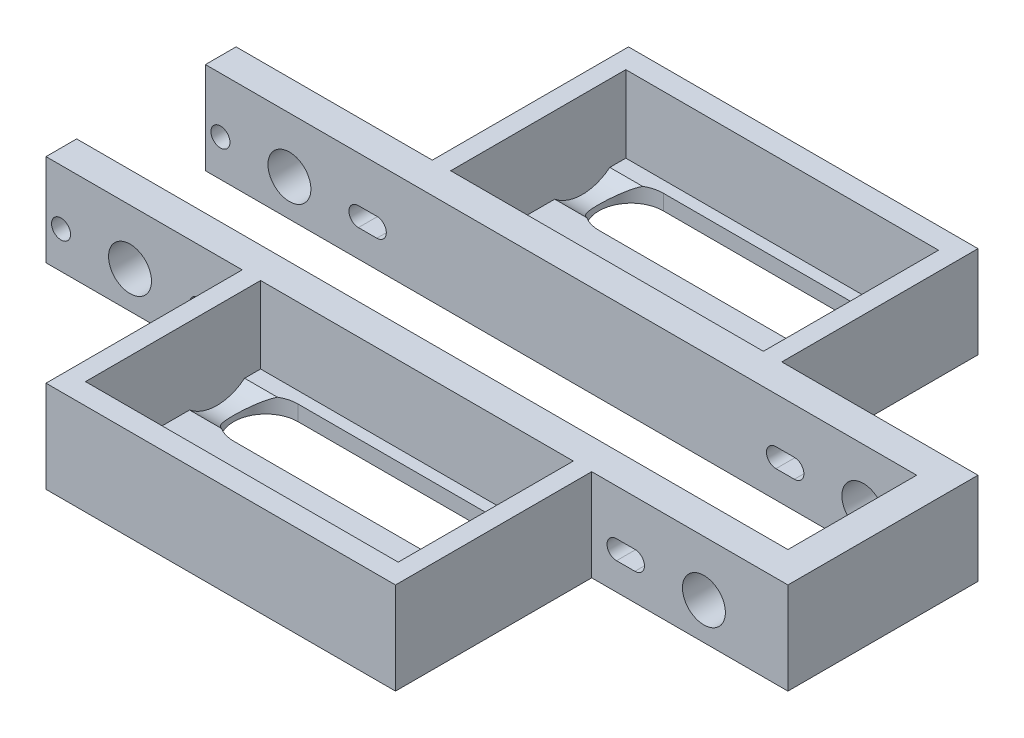
from build123d import *

# Parameters (mm, degrees)
SKETCH1_W                  = 51
SKETCH1_H                  = 28.56
TOTALHEIGHT_DEPTH          = 15
SKETCH1_3_W                = 51
SKETCH1_3_H                = 28.56
FLOORHEIGHT_DEPTH          = 2.5
HOLESFORBEARINGMOUNT_REACH = 139.241
SKETCH2_R                  = 1.55
SKETCH2_R_2                = 3.5
CUT_EXTRUDE2_REACH         = 131.019


with BuildPart() as part:
    # Sketch1 → TotalHeight (new body)
    with BuildSketch(Plane(origin=(0, 0, 0), x_dir=(1, 0, 0), z_dir=(0, 1, 0))):
        Polygon((32, 32), (32, 0), (89, 0), (89, 32), (121, 32), (121, 47.5), (121, 63), (89, 63), (89, 95), (32, 95), (32, 63), (0, 63), (0, 58), (5, 58), (116, 58), (116, 37), (5, 37), (0, 37), (0, 32), align=None)
        with Locations((60.5, 17.72)):
            Rectangle(SKETCH1_W, SKETCH1_H, mode=Mode.SUBTRACT)
        with Locations((60.5, 77.28)):
            Rectangle(SKETCH1_W, SKETCH1_H, mode=Mode.SUBTRACT)
    extrude(amount=TOTALHEIGHT_DEPTH)

    # Sketch1<3> → FloorHeight (add)
    # profile 1 of 2: a face of its own
    with BuildSketch(Plane(origin=(0, 0, 0), x_dir=(1, 0, 0), z_dir=(0, 1, 0))):
        with Locations((60.5, 77.28)):
            Rectangle(SKETCH1_3_W, SKETCH1_3_H)
        with BuildLine():
            ThreePointArc((78, 79.17), (83.25, 84.42), (78, 89.67))
            Line((78, 89.67), (43, 89.67))
            ThreePointArc((43, 89.67), (37.75, 84.42), (43, 79.17))
            Line((43, 79.17), (78, 79.17))
        make_face(mode=Mode.SUBTRACT)
        with BuildLine():
            Line((43, 75.39), (78, 75.39))
            ThreePointArc((78, 75.39), (83.25, 70.14), (78, 64.89))
            Line((78, 64.89), (43, 64.89))
            ThreePointArc((43, 64.89), (37.75, 70.14), (43, 75.39))
        make_face(mode=Mode.SUBTRACT)
    # profile 2 of 2: a face of its own
    with BuildSketch(Plane(origin=(0, 0, 0), x_dir=(1, 0, 0), z_dir=(0, 1, 0))):
        with Locations((60.5, 17.72)):
            Rectangle(SKETCH1_3_W, SKETCH1_3_H)
        with BuildLine():
            ThreePointArc((78, 19.61), (83.25, 24.86), (78, 30.11))
            Line((78, 30.11), (43, 30.11))
            ThreePointArc((43, 30.11), (37.75, 24.86), (43, 19.61))
            Line((43, 19.61), (78, 19.61))
        make_face(mode=Mode.SUBTRACT)
        with BuildLine():
            Line((43, 15.83), (78, 15.83))
            ThreePointArc((78, 15.83), (83.25, 10.58), (78, 5.33))
            Line((78, 5.33), (43, 5.33))
            ThreePointArc((43, 5.33), (37.75, 10.58), (43, 15.83))
        make_face(mode=Mode.SUBTRACT)
    extrude(amount=FLOORHEIGHT_DEPTH)

    # HolesForBearingMount: up to this face of the body (flat: up to its plane)
    holesforbearingmount_end = Plane(part.part.faces().sort_by_distance((16, 7.5, -63))[0])
    # Sketch2 → HolesForBearingMount (cut, up to the picked face)
    with BuildSketch(Plane.XY.offset(-32), mode=Mode.PRIVATE) as holesforbearingmount_sk1:
        with Locations((2.45, 6)):
            Circle(SKETCH2_R)
    holesforbearingmount_tool1 = split(extrude(holesforbearingmount_sk1.sketch, amount=-HOLESFORBEARINGMOUNT_REACH, mode=Mode.PRIVATE), bisect_by=holesforbearingmount_end, keep=Keep.BOTH, mode=Mode.PRIVATE)
    # Sketch2 → HolesForBearingMount (cut, up to the picked face)
    with BuildSketch(Plane.XY.offset(-32), mode=Mode.PRIVATE) as holesforbearingmount_sk2:
        with Locations((13.7, 6)):
            Circle(SKETCH2_R_2)
    holesforbearingmount_tool2 = split(extrude(holesforbearingmount_sk2.sketch, amount=-HOLESFORBEARINGMOUNT_REACH, mode=Mode.PRIVATE), bisect_by=holesforbearingmount_end, keep=Keep.BOTH, mode=Mode.PRIVATE)
    # Sketch2 → HolesForBearingMount (cut, up to the picked face)
    with BuildSketch(Plane.XY.offset(-32), mode=Mode.PRIVATE) as holesforbearingmount_sk3:
        with BuildLine():
            Line((24.95, 4.45), (27.95, 4.45))
            ThreePointArc((27.95, 4.45), (29.5, 6), (27.95, 7.55))
            Line((27.95, 7.55), (24.95, 7.55))
            ThreePointArc((24.95, 7.55), (23.4, 6), (24.95, 4.45))
        make_face()
    holesforbearingmount_tool3 = split(extrude(holesforbearingmount_sk3.sketch, amount=-HOLESFORBEARINGMOUNT_REACH, mode=Mode.PRIVATE), bisect_by=holesforbearingmount_end, keep=Keep.BOTH, mode=Mode.PRIVATE)
    # Sketch2 → HolesForBearingMount (cut, up to the picked face)
    with BuildSketch(Plane.XY.offset(-32), mode=Mode.PRIVATE) as holesforbearingmount_sk4:
        with BuildLine():
            ThreePointArc((93.05, 4.45), (91.5, 6), (93.05, 7.55))
            Line((93.05, 7.55), (96.05, 7.55))
            ThreePointArc((96.05, 7.55), (97.6, 6), (96.05, 4.45))
            Line((96.05, 4.45), (93.05, 4.45))
        make_face()
    holesforbearingmount_tool4 = split(extrude(holesforbearingmount_sk4.sketch, amount=-HOLESFORBEARINGMOUNT_REACH, mode=Mode.PRIVATE), bisect_by=holesforbearingmount_end, keep=Keep.BOTH, mode=Mode.PRIVATE)
    # Sketch2 → HolesForBearingMount (cut, up to the picked face)
    with BuildSketch(Plane.XY.offset(-32), mode=Mode.PRIVATE) as holesforbearingmount_sk5:
        with Locations((107.3, 6)):
            Circle(SKETCH2_R_2)
    holesforbearingmount_tool5 = split(extrude(holesforbearingmount_sk5.sketch, amount=-HOLESFORBEARINGMOUNT_REACH, mode=Mode.PRIVATE), bisect_by=holesforbearingmount_end, keep=Keep.BOTH, mode=Mode.PRIVATE)
    add(holesforbearingmount_tool1.solids().sort_by(Axis((2.45, 6, -32), (0, 0, -1)))[0], mode=Mode.SUBTRACT)
    add(holesforbearingmount_tool2.solids().sort_by(Axis((13.7, 6, -32), (0, 0, -1)))[0], mode=Mode.SUBTRACT)
    add(holesforbearingmount_tool3.solids().sort_by(Axis((26.45, 6, -32), (0, 0, -1)))[0], mode=Mode.SUBTRACT)
    add(holesforbearingmount_tool4.solids().sort_by(Axis((94.55, 6, -32), (0, 0, -1)))[0], mode=Mode.SUBTRACT)
    add(holesforbearingmount_tool5.solids().sort_by(Axis((107.3, 6, -32), (0, 0, -1)))[0], mode=Mode.SUBTRACT)

    # Cut-Extrude2: up to this face of the body (flat: up to its plane)
    cut_extrude2_end = Plane(part.part.faces().sort_by_distance((35, 8.75, -17.72))[0])
    # Sketch3 → Cut-Extrude2 (cut, up to the picked face)
    with BuildSketch(Plane.ZY.offset(-86), mode=Mode.PRIVATE) as cut_extrude2_sk1:
        with BuildLine():
            ThreePointArc((-77.36, 8), (-87.503934876, 14.414394786), (-88.949988864, 2.5))
            Line((-88.949988864, 2.5), (-79.970011136, 2.5))
            ThreePointArc((-79.970011136, 2.5), (-78.045605214, 4.956065124), (-77.36, 8))
        make_face()
    cut_extrude2_tool1 = split(extrude(cut_extrude2_sk1.sketch, amount=CUT_EXTRUDE2_REACH, mode=Mode.PRIVATE), bisect_by=cut_extrude2_end, keep=Keep.BOTH, mode=Mode.PRIVATE)
    # Sketch3 → Cut-Extrude2 (cut, up to the picked face)
    with BuildSketch(Plane.ZY.offset(-86), mode=Mode.PRIVATE) as cut_extrude2_sk2:
        with BuildLine():
            Line((-79.970011136, 2.5), (-88.949988864, 2.5))
            ThreePointArc((-88.949988864, 2.5), (-84.46, 0.9), (-79.970011136, 2.5))
        make_face()
    cut_extrude2_tool2 = split(extrude(cut_extrude2_sk2.sketch, amount=CUT_EXTRUDE2_REACH, mode=Mode.PRIVATE), bisect_by=cut_extrude2_end, keep=Keep.BOTH, mode=Mode.PRIVATE)
    # Sketch3 → Cut-Extrude2 (cut, up to the picked face)
    with BuildSketch(Plane.ZY.offset(-86), mode=Mode.PRIVATE) as cut_extrude2_sk3:
        with BuildLine():
            ThreePointArc((-63, 8), (-73.143934876, 14.414394786), (-74.589988864, 2.5))
            Line((-74.589988864, 2.5), (-65.610011136, 2.5))
            ThreePointArc((-65.610011136, 2.5), (-63.685605214, 4.956065124), (-63, 8))
        make_face()
    cut_extrude2_tool3 = split(extrude(cut_extrude2_sk3.sketch, amount=CUT_EXTRUDE2_REACH, mode=Mode.PRIVATE), bisect_by=cut_extrude2_end, keep=Keep.BOTH, mode=Mode.PRIVATE)
    # Sketch3 → Cut-Extrude2 (cut, up to the picked face)
    with BuildSketch(Plane.ZY.offset(-86), mode=Mode.PRIVATE) as cut_extrude2_sk4:
        with BuildLine():
            Line((-65.610011136, 2.5), (-74.589988864, 2.5))
            ThreePointArc((-74.589988864, 2.5), (-70.1, 0.9), (-65.610011136, 2.5))
        make_face()
    cut_extrude2_tool4 = split(extrude(cut_extrude2_sk4.sketch, amount=CUT_EXTRUDE2_REACH, mode=Mode.PRIVATE), bisect_by=cut_extrude2_end, keep=Keep.BOTH, mode=Mode.PRIVATE)
    # Sketch3 → Cut-Extrude2 (cut, up to the picked face)
    with BuildSketch(Plane.ZY.offset(-86), mode=Mode.PRIVATE) as cut_extrude2_sk5:
        with BuildLine():
            ThreePointArc((-17.8, 8), (-27.943934876, 14.414394786), (-29.389988864, 2.5))
            Line((-29.389988864, 2.5), (-20.410011136, 2.5))
            ThreePointArc((-20.410011136, 2.5), (-18.485605214, 4.956065124), (-17.8, 8))
        make_face()
    cut_extrude2_tool5 = split(extrude(cut_extrude2_sk5.sketch, amount=CUT_EXTRUDE2_REACH, mode=Mode.PRIVATE), bisect_by=cut_extrude2_end, keep=Keep.BOTH, mode=Mode.PRIVATE)
    # Sketch3 → Cut-Extrude2 (cut, up to the picked face)
    with BuildSketch(Plane.ZY.offset(-86), mode=Mode.PRIVATE) as cut_extrude2_sk6:
        with BuildLine():
            Line((-20.410011136, 2.5), (-29.389988864, 2.5))
            ThreePointArc((-29.389988864, 2.5), (-24.9, 0.9), (-20.410011136, 2.5))
        make_face()
    cut_extrude2_tool6 = split(extrude(cut_extrude2_sk6.sketch, amount=CUT_EXTRUDE2_REACH, mode=Mode.PRIVATE), bisect_by=cut_extrude2_end, keep=Keep.BOTH, mode=Mode.PRIVATE)
    # Sketch3 → Cut-Extrude2 (cut, up to the picked face)
    with BuildSketch(Plane.ZY.offset(-86), mode=Mode.PRIVATE) as cut_extrude2_sk7:
        with BuildLine():
            ThreePointArc((-3.44, 8), (-13.583934876, 14.414394786), (-15.029988864, 2.5))
            Line((-15.029988864, 2.5), (-6.050011136, 2.5))
            ThreePointArc((-6.050011136, 2.5), (-4.125605214, 4.956065124), (-3.44, 8))
        make_face()
    cut_extrude2_tool7 = split(extrude(cut_extrude2_sk7.sketch, amount=CUT_EXTRUDE2_REACH, mode=Mode.PRIVATE), bisect_by=cut_extrude2_end, keep=Keep.BOTH, mode=Mode.PRIVATE)
    # Sketch3 → Cut-Extrude2 (cut, up to the picked face)
    with BuildSketch(Plane.ZY.offset(-86), mode=Mode.PRIVATE) as cut_extrude2_sk8:
        with BuildLine():
            Line((-6.050011136, 2.5), (-15.029988864, 2.5))
            ThreePointArc((-15.029988864, 2.5), (-10.54, 0.9), (-6.050011136, 2.5))
        make_face()
    cut_extrude2_tool8 = split(extrude(cut_extrude2_sk8.sketch, amount=CUT_EXTRUDE2_REACH, mode=Mode.PRIVATE), bisect_by=cut_extrude2_end, keep=Keep.BOTH, mode=Mode.PRIVATE)
    add(cut_extrude2_tool1.solids().sort_by(Axis((86, 8.40623, -84.46), (-1, 0, 0)))[0], mode=Mode.SUBTRACT)
    add(cut_extrude2_tool2.solids().sort_by(Axis((86, 1.853386, -84.46), (-1, 0, 0)))[0], mode=Mode.SUBTRACT)
    add(cut_extrude2_tool3.solids().sort_by(Axis((86, 8.40623, -70.1), (-1, 0, 0)))[0], mode=Mode.SUBTRACT)
    add(cut_extrude2_tool4.solids().sort_by(Axis((86, 1.853386, -70.1), (-1, 0, 0)))[0], mode=Mode.SUBTRACT)
    add(cut_extrude2_tool5.solids().sort_by(Axis((86, 8.40623, -24.9), (-1, 0, 0)))[0], mode=Mode.SUBTRACT)
    add(cut_extrude2_tool6.solids().sort_by(Axis((86, 1.853386, -24.9), (-1, 0, 0)))[0], mode=Mode.SUBTRACT)
    add(cut_extrude2_tool7.solids().sort_by(Axis((86, 8.40623, -10.54), (-1, 0, 0)))[0], mode=Mode.SUBTRACT)
    add(cut_extrude2_tool8.solids().sort_by(Axis((86, 1.853386, -10.54), (-1, 0, 0)))[0], mode=Mode.SUBTRACT)


solid = part.part
